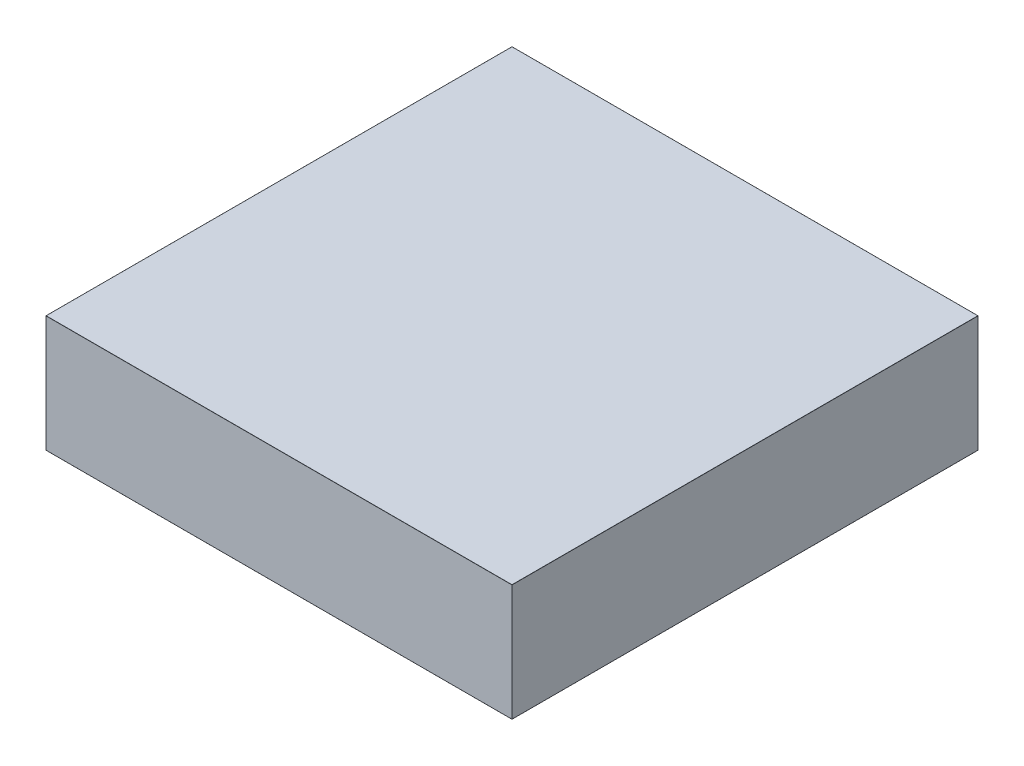
from build123d import *

# Parameters (mm, degrees)
SKETCH1_W           = 400
SKETCH1_H           = 100
BOSS_EXTRUDE1_DEPTH = 200
FILLET1_R           = 0.1


with BuildPart() as part:
    # Sketch1 → Boss-Extrude1 (new, symmetric)
    with BuildSketch(Plane.XY):
        Rectangle(SKETCH1_W, SKETCH1_H)
    extrude(amount=BOSS_EXTRUDE1_DEPTH, both=True)

    # Fillet1
    fillet1_edges = [part.edges().sort_by_distance(p)[0] for p in [
        (-200, 0, 200),
        (0, -50, 200),
        (200, 0, 200),
        (0, -50, -200),
        (-200, 0, -200),
        (0, 50, -200),
        (200, 0, -200),
        (200, -50, 0),
        (-200, -50, 0),
        (-200, 50, 0),
        (200, 50, 0),
        (0, 50, 200),
    ]]
    fillet(fillet1_edges, radius=FILLET1_R)


solid = part.part
